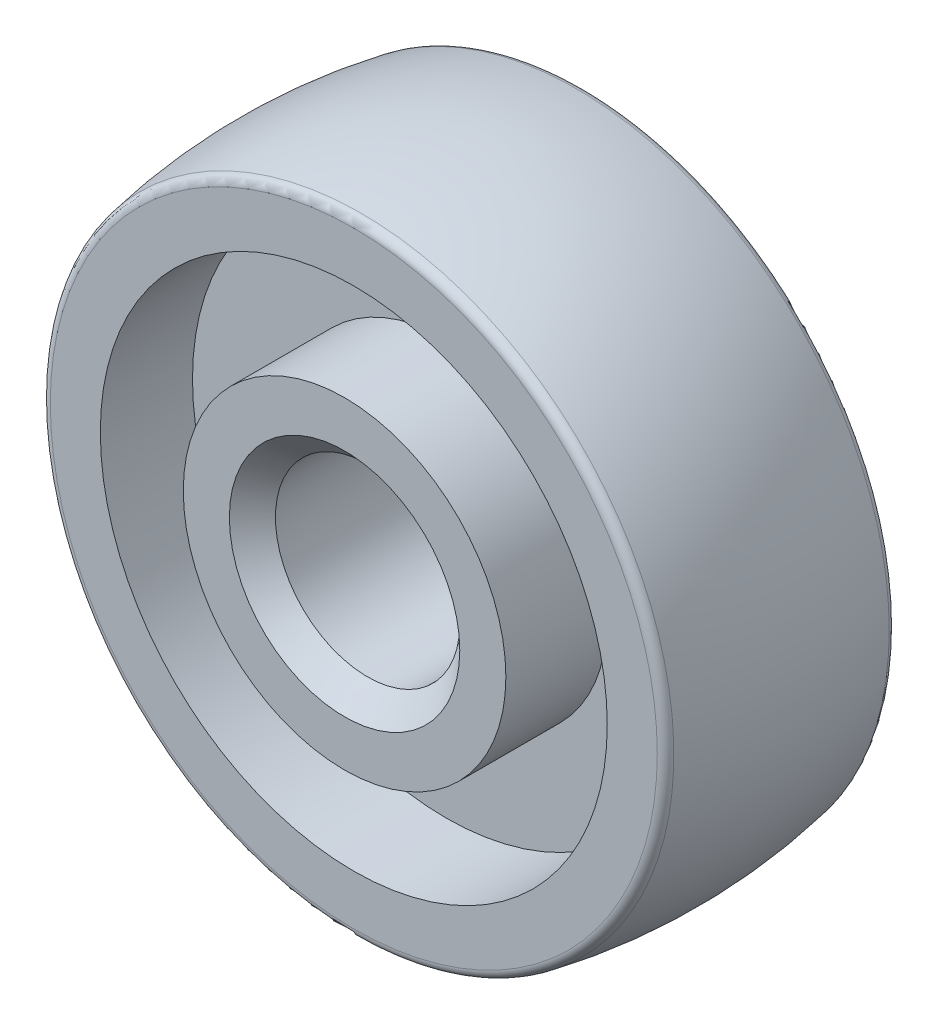
from build123d import *

# Parameters (mm, degrees)
EXTRUDE_1_DEPTH      = 0.2
EXTRUDE_1_DEPTH_BACK = 5.2
SKETCH_2_R           = 3.5
CUT_EXTRUDE_1_REACH  = 13.277
SKETCH_3_R           = 2
SKETCH_4_R           = 5.5
SKETCH_4_R_2         = 3.5
CUT_EXTRUDE_2_DEPTH  = 2
CUT_EXTRUDE_START    = -2
SKETCH_5_R           = 5.5
SKETCH_5_R_2         = 3.5
CUT_EXTRUDE_3_DEPTH  = 2
FILLET_1_R           = 0.2
CHAMFER_1_SIZE       = 0.5


with BuildPart() as part:
    # 草图1 → 旋转1 (revolve)
    with BuildSketch(Plane(origin=(0, 0, 0), x_dir=(0, 0, -1), z_dir=(1, 0, 0)), mode=Mode.PRIVATE) as revolve_1_sk:
        with BuildLine():
            Line((-2.5, 0), (-2.5, 6.75))
            ThreePointArc((-2.5, 6.75), (-1.256234453, 6.937344526), (0, 7))
            ThreePointArc((0, 7), (1.256234453, 6.937344526), (2.5, 6.75))
            Line((2.5, 6.75), (2.5, 0))
            Line((2.5, 0), (-2.5, 0))
        make_face()
    revolve(revolve_1_sk.sketch.rotate(Axis((0, 0, 3.62963917), (0, 0, -1)), 90), axis=Axis((0, 0, 3.62963917), (0, 0, -1)))

    # 草图2 → 凸台-拉伸1 (add, two sides: drawn at the far end of the back side and taken through both)
    with BuildSketch(Plane.XY.offset(2.5).offset(-EXTRUDE_1_DEPTH_BACK)):
        Circle(SKETCH_2_R)
    extrude(amount=EXTRUDE_1_DEPTH + EXTRUDE_1_DEPTH_BACK)

    # 草图3 → 切除-拉伸1 (cut, up to next)
    with BuildSketch(Plane.XY.offset(2.7), mode=Mode.PRIVATE) as cut_extrude_1_sk1:
        Circle(SKETCH_3_R)
    cut_extrude_1_tool1 = extrude(cut_extrude_1_sk1.sketch, amount=-CUT_EXTRUDE_1_REACH, mode=Mode.PRIVATE) & part.part
    add(cut_extrude_1_tool1.solids().sort_by_distance((0, 0, 2.7))[0], mode=Mode.SUBTRACT)

    # 草图4 → 切除-拉伸2 (cut)
    with BuildSketch(Plane.XY.offset(2.5)):
        Circle(SKETCH_4_R)
        Circle(SKETCH_4_R_2, mode=Mode.SUBTRACT)
    extrude(amount=-CUT_EXTRUDE_2_DEPTH, mode=Mode.SUBTRACT)

    # 草图5 → 切除-拉伸3 (cut)
    with BuildSketch(Plane(origin=(0, 0, -2.5), x_dir=(-1, 0, 0), z_dir=(0, 0, -1)).offset(CUT_EXTRUDE_START)):
        with Locations(Location((0, 0, 0), (0, 0, 180))):
            Circle(SKETCH_5_R)
        with Locations(Location((0, 0, 0), (0, 0, 180))):
            Circle(SKETCH_5_R_2, mode=Mode.SUBTRACT)
    extrude(amount=CUT_EXTRUDE_3_DEPTH, mode=Mode.SUBTRACT)

    # 圆角1
    fillet_1_edges = [part.edges().sort_by_distance(p)[0] for p in [
        (-6.75, 0, 2.5),
        (-6.75, 0, -2.5),
    ]]
    fillet(fillet_1_edges, radius=FILLET_1_R)

    # 倒角1
    chamfer_1_edges = [part.edges().sort_by_distance(p)[0] for p in [
        (-2, 0, 2.7),
        (-2, 0, -2.7),
    ]]
    chamfer(chamfer_1_edges, length=CHAMFER_1_SIZE)


solid = part.part
